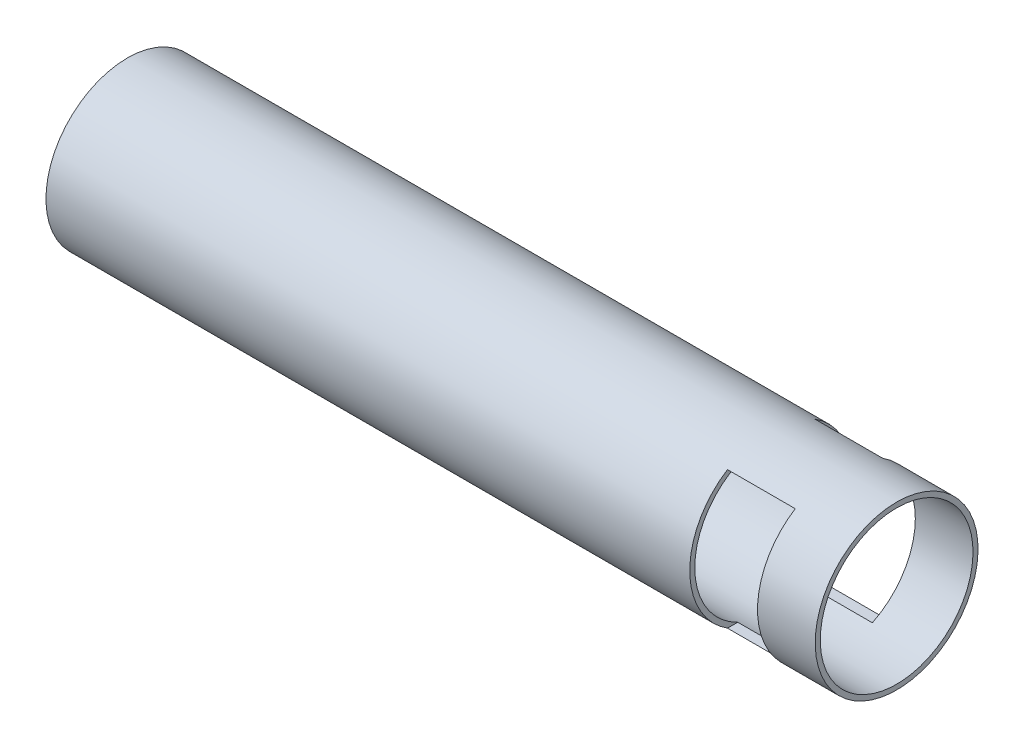
from build123d import *

# Parameters (mm, degrees)
SKETCH12_R              = 44.45
SKETCH12_R_2            = 41.7068
PIPE_0_5_SCH_40_1_DEPTH = 420
CUT_EXTRUDE1_DEPTH      = 50
CUT_EXTRUDE1_DEPTH_BACK = 50
SKETCH13_W              = 37
SKETCH13_H              = 75


with BuildPart() as part:
    # Sketch12 → Pipe 0.5 SCH 40(1) (new body)
    with BuildSketch(Plane.YZ.offset(-210)):
        Circle(SKETCH12_R)
        Circle(SKETCH12_R_2, mode=Mode.SUBTRACT)
    extrude(amount=PIPE_0_5_SCH_40_1_DEPTH)

    # Sketch13 → Cut-Extrude1 (cut, two sides: drawn at the far end of the back side and taken through both)
    with BuildSketch(Plane.XY.offset(-CUT_EXTRUDE1_DEPTH_BACK)):
        with Locations((160, 0)):
            Rectangle(SKETCH13_W, SKETCH13_H)
    extrude(amount=CUT_EXTRUDE1_DEPTH + CUT_EXTRUDE1_DEPTH_BACK, mode=Mode.SUBTRACT)


solid = part.part
